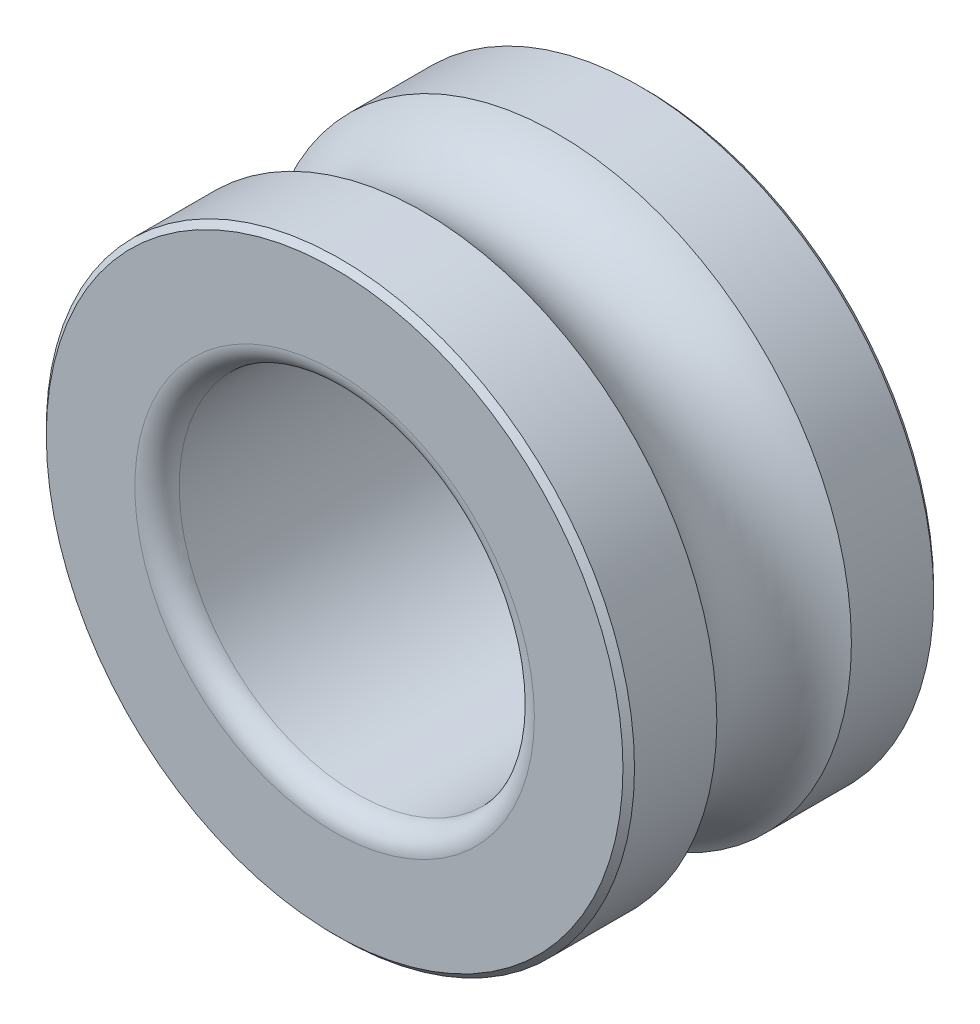
from build123d import *


with BuildPart() as part:
    # Sketch2 → Revolve1 (revolve)
    with BuildSketch(Plane(origin=(0, 0, 0), x_dir=(0, 0, -1), z_dir=(1, 0, 0)), mode=Mode.PRIVATE) as revolve1_sk:
        with BuildLine():
            Line((3, 4), (-3, 4))
            ThreePointArc((-3, 4), (-3.353553391, 4.146446609), (-3.5, 4.5))
            Line((-3.5, 4.5), (-3.5, 6.495))
            Line((-3.5, 6.495), (-3.37, 6.625))
            Line((-3.37, 6.625), (-1.515544457, 6.625))
            ThreePointArc((-1.515544457, 6.625), (0, 5.75), (1.515544457, 6.625))
            Line((1.515544457, 6.625), (3.37, 6.625))
            Line((3.37, 6.625), (3.5, 6.495))
            Line((3.5, 6.495), (3.5, 4.5))
            ThreePointArc((3.5, 4.5), (3.353553391, 4.146446609), (3, 4))
        make_face()
    revolve(revolve1_sk.sketch.rotate(Axis((0, 0, 3.5), (0, 0, -1)), 90), axis=Axis((0, 0, 3.5), (0, 0, -1)))


solid = part.part
